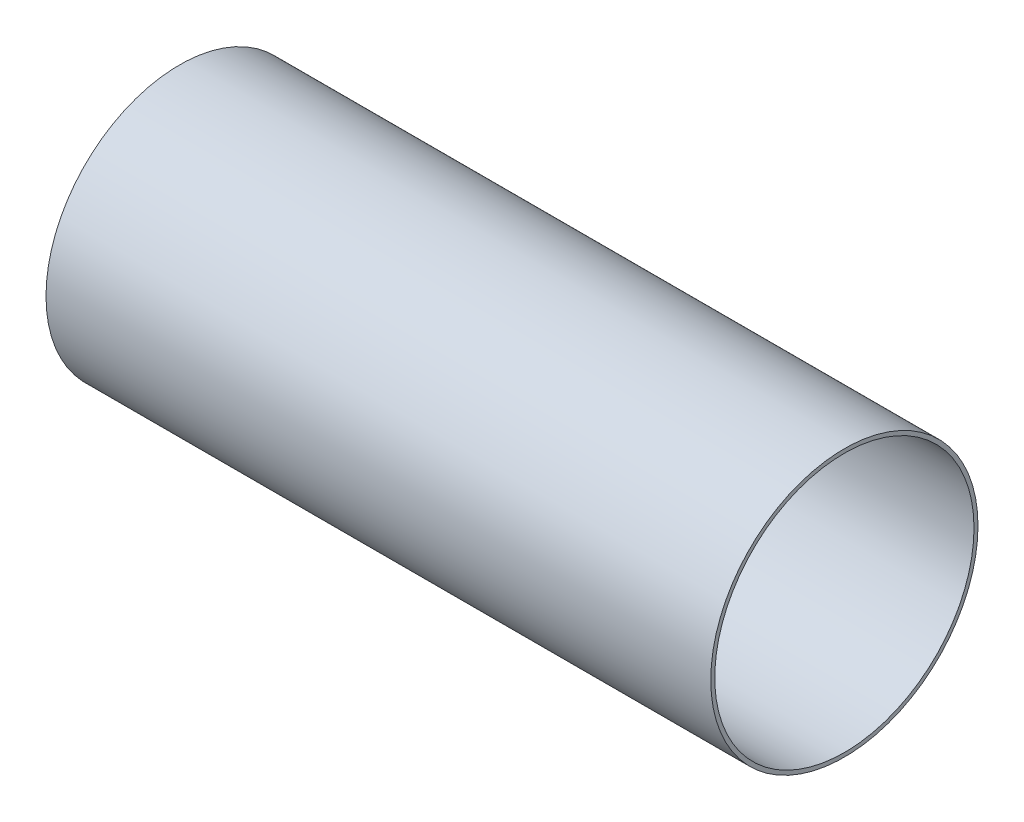
from build123d import *

# Parameters (mm, degrees)
BOSS_EXTRUDE1_DEPTH      = 127
BOSS_EXTRUDE1_DEPTH_BACK = 127
SKETCH1_R                = 51.054
SKETCH1_R_2              = 49.53


with BuildPart() as part:
    # Sketch1 → Boss-Extrude1 (new, two sides: drawn at the far end of the back side and taken through both)
    with BuildSketch(Plane.YZ.offset(-BOSS_EXTRUDE1_DEPTH_BACK)):
        Circle(SKETCH1_R)
        Circle(SKETCH1_R_2, mode=Mode.SUBTRACT)
    extrude(amount=BOSS_EXTRUDE1_DEPTH + BOSS_EXTRUDE1_DEPTH_BACK)


solid = part.part
